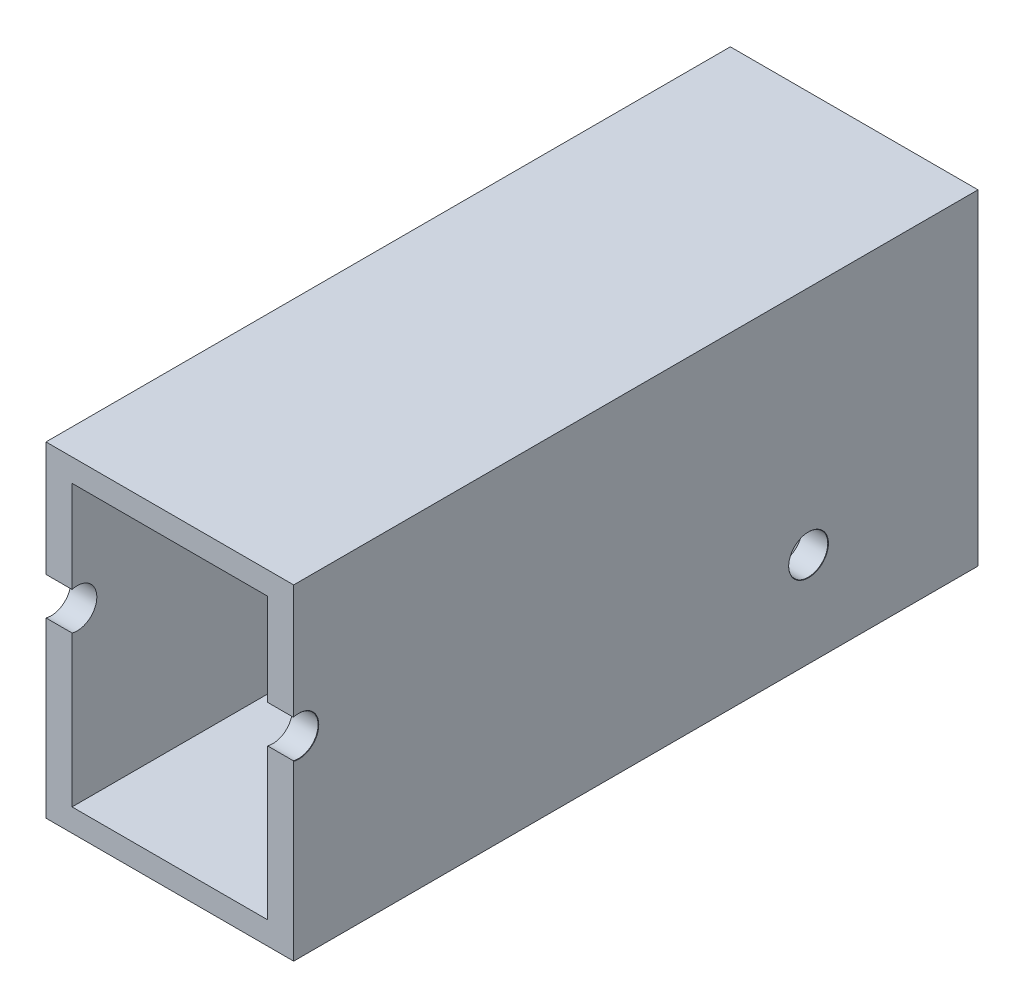
from build123d import *

# Parameters (mm, degrees)
BOSS_EXTRUDE1_DEPTH             = 7.5
BOSS_EXTRUDE1_DEPTH_BACK        = 7.5
SKETCH2_W                       = 25
SKETCH2_H                       = 52.5
BOSS_EXTRUDE2_DEPTH             = 2
F_3_0MM_DOWEL_HOLE1_D           = 3
F_3_0MM_DOWEL_HOLE1_CSINK_D     = 3.05
F_3_0MM_DOWEL_HOLE1_CSINK_ANGLE = 90


with BuildPart() as part:
    # Sketch1 → Boss-Extrude1 (new, two sides: drawn at the far end of the back side and taken through both)
    with BuildSketch(Plane.YZ.offset(-BOSS_EXTRUDE1_DEPTH_BACK)):
        Polygon((-10.75, -21.25), (-10.75, 21.25), (-12.5, 21.25), (-12.5, -31.25), (12.5, -31.25), (12.5, 21.25), (10.75, 21.25), (10.75, -15.25), (-2.25, -15.25), (-2.25, -21.25), align=None)
    extrude(amount=BOSS_EXTRUDE1_DEPTH + BOSS_EXTRUDE1_DEPTH_BACK)

    # Sketch2 → Boss-Extrude2 (add)
    with BuildSketch(Plane.YZ.offset(7.5)):
        with Locations((0, -5)):
            Rectangle(SKETCH2_W, SKETCH2_H)
    boss_extrude2 = extrude(amount=BOSS_EXTRUDE2_DEPTH)

    # Mirror2: Boss-Extrude2 across plane
    add(boss_extrude2.mirror(Plane(origin=(0, 0, 0), x_dir=(0, 0, 1), z_dir=(1, 0, 0))))

    # Ø3.0mm Dowel Hole1 (through all)
    with Locations(Plane.YZ.offset(9.5)):
        with Locations((2.25, 20.85), (-5.25, -18.25)):
            CounterSinkHole(F_3_0MM_DOWEL_HOLE1_D / 2, F_3_0MM_DOWEL_HOLE1_CSINK_D / 2, counter_sink_angle=F_3_0MM_DOWEL_HOLE1_CSINK_ANGLE)


solid = part.part
